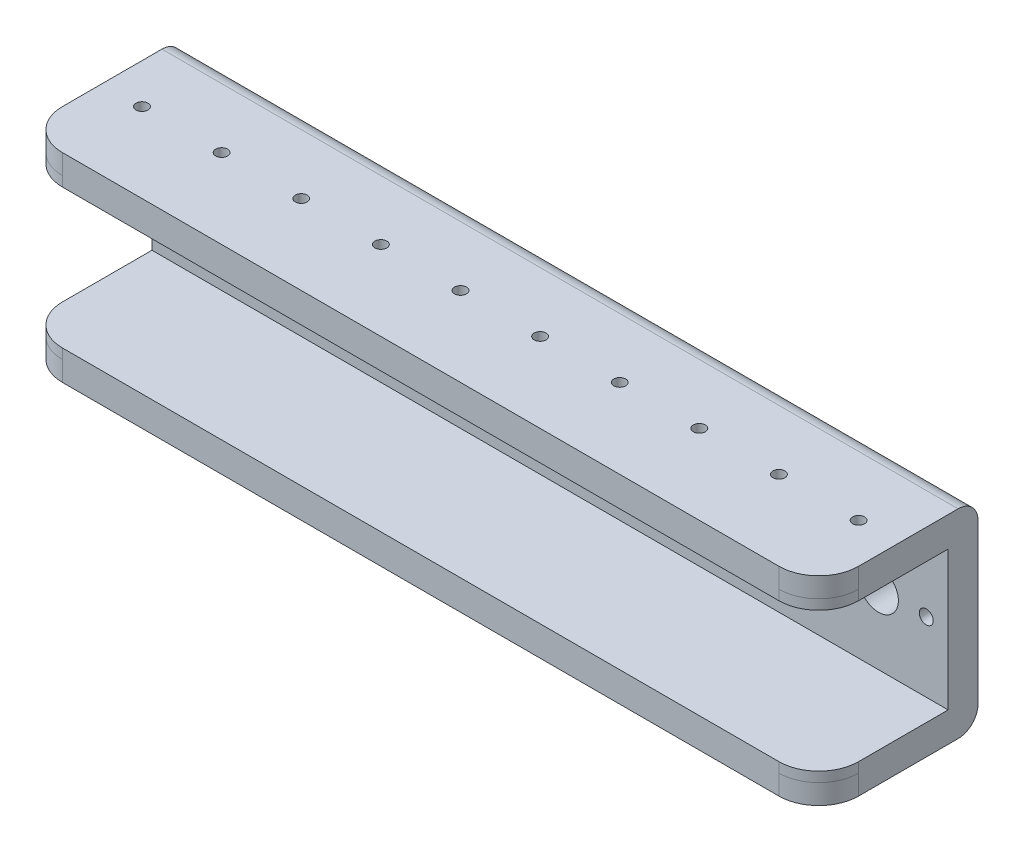
from build123d import *

# Parameters (mm, degrees)
SKETCH1_W           = 400
SKETCH1_H           = 80
BOSS_EXTRUDE1_DEPTH = 10
SKETCH2_W           = 400
SKETCH2_H           = 10
BOSS_EXTRUDE2_DEPTH = 80
SKETCH3_W           = 400
SKETCH3_H           = 10
BOSS_EXTRUDE3_DEPTH = 10
SKETCH4_W           = 400
SKETCH4_H           = 10
BOSS_EXTRUDE4_DEPTH = 70
FILLET1_R           = 20
FILLET2_R           = 10
SKETCH7_R           = 8.5
SKETCH7_R_2         = 3.5
SKETCH7_R_3         = 10
CUT_EXTRUDE1_DEPTH  = 10
CUT_EXTRUDE2_REACH  = 358.158
SKETCH8_R           = 3
SKETCH9_W           = 400
SKETCH9_H           = 80
SKETCH9_R           = 10
SKETCH9_R_2         = 3.5
SKETCH9_R_3         = 8.5
BOSS_EXTRUDE5_DEPTH = 5
SKETCH10_W          = 400
SKETCH10_H          = 65
SKETCH10_R          = 3
BOSS_EXTRUDE6_DEPTH = 5
SKETCH11_W          = 400
SKETCH11_H          = 65
BOSS_EXTRUDE7_DEPTH = 5
FILLET3_R           = 20


with BuildPart() as part:
    # Sketch1 → Boss-Extrude1 (new body)
    with BuildSketch(Plane(origin=(0, 0, 0), x_dir=(1, 0, 0), z_dir=(0, 1, 0))):
        with Locations((135.921268108, 23.289271879)):
            Rectangle(SKETCH1_W, SKETCH1_H)
    extrude(amount=BOSS_EXTRUDE1_DEPTH)

    # Sketch2 → Boss-Extrude2 (add)
    with BuildSketch(Plane(origin=(0, 10, 0), x_dir=(1, 0, 0), z_dir=(0, 1, 0))):
        with Locations((135.921268108, 58.289271879)):
            Rectangle(SKETCH2_W, SKETCH2_H)
    extrude(amount=BOSS_EXTRUDE2_DEPTH)

    # Sketch3 → Boss-Extrude3 (add)
    with BuildSketch(Plane(origin=(0, 90, 0), x_dir=(1, 0, 0), z_dir=(0, 1, 0))):
        with Locations((135.921268108, 58.289271879)):
            Rectangle(SKETCH3_W, SKETCH3_H)
    extrude(amount=BOSS_EXTRUDE3_DEPTH)

    # Sketch4 → Boss-Extrude4 (add)
    with BuildSketch(Plane.XY.offset(-53.289271879)):
        with Locations((135.921268108, 95)):
            Rectangle(SKETCH4_W, SKETCH4_H)
    extrude(amount=BOSS_EXTRUDE4_DEPTH)

    # Fillet1
    fillet1_edges = [part.edges().sort_by_distance(p)[0] for p in [
        (-64.078731892, 95, 16.710728121),
        (335.921268108, 95, 16.710728121),
        (-64.078731892, 5, 16.710728121),
        (335.921268108, 5, 16.710728121),
    ]]
    fillet(fillet1_edges, radius=FILLET1_R)

    # Fillet2
    fillet2_edges = [part.edges().sort_by_distance(p)[0] for p in [
        (135.921268108, 100, -63.289271879),
        (135.921268108, 0, -63.289271879),
    ]]
    fillet(fillet2_edges, radius=FILLET2_R)

    # Sketch7 → Cut-Extrude1 (cut)
    with BuildSketch(Plane(origin=(0, 0, -63.289271879), x_dir=(-1, 0, 0), z_dir=(0, 0, -1))):
        with Locations((-135.921268108, 50)):
            Circle(SKETCH7_R)
        with Locations((-109.421268108, 50)):
            Circle(SKETCH7_R_2)
        with Locations((-162.421268108, 50)):
            Circle(SKETCH7_R_2)
        with Locations((-324.921268108, 50)):
            Circle(SKETCH7_R_2)
        with Locations((-300.921268108, 50)):
            Circle(SKETCH7_R_3)
        with Locations((-276.921268108, 50)):
            Circle(SKETCH7_R_2)
        with Locations((53.078731892, 50)):
            Circle(SKETCH7_R_2)
        with Locations((29.078731892, 50)):
            Circle(SKETCH7_R_3)
        with Locations((5.078731892, 50)):
            Circle(SKETCH7_R_2)
    extrude(amount=-CUT_EXTRUDE1_DEPTH, mode=Mode.SUBTRACT)

    # Sketch8 → Cut-Extrude2 (cut, up to next)
    with BuildSketch(Plane(origin=(0, 100, 0), x_dir=(1, 0, 0), z_dir=(0, 1, 0)), mode=Mode.PRIVATE) as cut_extrude2_sk1:
        with Locations(Location((-44.078731892, 23.289271879, 0), (0, 0, 270))):
            Circle(SKETCH8_R)
    cut_extrude2_tool1 = extrude(cut_extrude2_sk1.sketch, amount=-CUT_EXTRUDE2_REACH, mode=Mode.PRIVATE) & part.part
    # Sketch8 → Cut-Extrude2 (cut, up to next)
    with BuildSketch(Plane(origin=(0, 100, 0), x_dir=(1, 0, 0), z_dir=(0, 1, 0)), mode=Mode.PRIVATE) as cut_extrude2_sk2:
        with Locations(Location((-4.078731892, 23.289271879, 0), (0, 0, 270))):
            Circle(SKETCH8_R)
    cut_extrude2_tool2 = extrude(cut_extrude2_sk2.sketch, amount=-CUT_EXTRUDE2_REACH, mode=Mode.PRIVATE) & part.part
    # Sketch8 → Cut-Extrude2 (cut, up to next)
    with BuildSketch(Plane(origin=(0, 100, 0), x_dir=(1, 0, 0), z_dir=(0, 1, 0)), mode=Mode.PRIVATE) as cut_extrude2_sk3:
        with Locations(Location((35.921268108, 23.289271879, 0), (0, 0, 270))):
            Circle(SKETCH8_R)
    cut_extrude2_tool3 = extrude(cut_extrude2_sk3.sketch, amount=-CUT_EXTRUDE2_REACH, mode=Mode.PRIVATE) & part.part
    # Sketch8 → Cut-Extrude2 (cut, up to next)
    with BuildSketch(Plane(origin=(0, 100, 0), x_dir=(1, 0, 0), z_dir=(0, 1, 0)), mode=Mode.PRIVATE) as cut_extrude2_sk4:
        with Locations(Location((75.921268108, 23.289271879, 0), (0, 0, 270))):
            Circle(SKETCH8_R)
    cut_extrude2_tool4 = extrude(cut_extrude2_sk4.sketch, amount=-CUT_EXTRUDE2_REACH, mode=Mode.PRIVATE) & part.part
    # Sketch8 → Cut-Extrude2 (cut, up to next)
    with BuildSketch(Plane(origin=(0, 100, 0), x_dir=(1, 0, 0), z_dir=(0, 1, 0)), mode=Mode.PRIVATE) as cut_extrude2_sk5:
        with Locations(Location((115.921268108, 23.289271879, 0), (0, 0, 270))):
            Circle(SKETCH8_R)
    cut_extrude2_tool5 = extrude(cut_extrude2_sk5.sketch, amount=-CUT_EXTRUDE2_REACH, mode=Mode.PRIVATE) & part.part
    # Sketch8 → Cut-Extrude2 (cut, up to next)
    with BuildSketch(Plane(origin=(0, 100, 0), x_dir=(1, 0, 0), z_dir=(0, 1, 0)), mode=Mode.PRIVATE) as cut_extrude2_sk6:
        with Locations(Location((155.921268108, 23.289271879, 0), (0, 0, 270))):
            Circle(SKETCH8_R)
    cut_extrude2_tool6 = extrude(cut_extrude2_sk6.sketch, amount=-CUT_EXTRUDE2_REACH, mode=Mode.PRIVATE) & part.part
    # Sketch8 → Cut-Extrude2 (cut, up to next)
    with BuildSketch(Plane(origin=(0, 100, 0), x_dir=(1, 0, 0), z_dir=(0, 1, 0)), mode=Mode.PRIVATE) as cut_extrude2_sk7:
        with Locations(Location((195.921268108, 23.289271879, 0), (0, 0, 270))):
            Circle(SKETCH8_R)
    cut_extrude2_tool7 = extrude(cut_extrude2_sk7.sketch, amount=-CUT_EXTRUDE2_REACH, mode=Mode.PRIVATE) & part.part
    # Sketch8 → Cut-Extrude2 (cut, up to next)
    with BuildSketch(Plane(origin=(0, 100, 0), x_dir=(1, 0, 0), z_dir=(0, 1, 0)), mode=Mode.PRIVATE) as cut_extrude2_sk8:
        with Locations(Location((235.921268108, 23.289271879, 0), (0, 0, 270))):
            Circle(SKETCH8_R)
    cut_extrude2_tool8 = extrude(cut_extrude2_sk8.sketch, amount=-CUT_EXTRUDE2_REACH, mode=Mode.PRIVATE) & part.part
    # Sketch8 → Cut-Extrude2 (cut, up to next)
    with BuildSketch(Plane(origin=(0, 100, 0), x_dir=(1, 0, 0), z_dir=(0, 1, 0)), mode=Mode.PRIVATE) as cut_extrude2_sk9:
        with Locations(Location((275.921268108, 23.289271879, 0), (0, 0, 270))):
            Circle(SKETCH8_R)
    cut_extrude2_tool9 = extrude(cut_extrude2_sk9.sketch, amount=-CUT_EXTRUDE2_REACH, mode=Mode.PRIVATE) & part.part
    # Sketch8 → Cut-Extrude2 (cut, up to next)
    with BuildSketch(Plane(origin=(0, 100, 0), x_dir=(1, 0, 0), z_dir=(0, 1, 0)), mode=Mode.PRIVATE) as cut_extrude2_sk10:
        with Locations(Location((315.921268108, 23.289271879, 0), (0, 0, 270))):
            Circle(SKETCH8_R)
    cut_extrude2_tool10 = extrude(cut_extrude2_sk10.sketch, amount=-CUT_EXTRUDE2_REACH, mode=Mode.PRIVATE) & part.part
    add(cut_extrude2_tool1.solids().sort_by_distance((-44.078732, 100, -23.289272))[0], mode=Mode.SUBTRACT)
    add(cut_extrude2_tool2.solids().sort_by_distance((-4.078732, 100, -23.289272))[0], mode=Mode.SUBTRACT)
    add(cut_extrude2_tool3.solids().sort_by_distance((35.921268, 100, -23.289272))[0], mode=Mode.SUBTRACT)
    add(cut_extrude2_tool4.solids().sort_by_distance((75.921268, 100, -23.289272))[0], mode=Mode.SUBTRACT)
    add(cut_extrude2_tool5.solids().sort_by_distance((115.921268, 100, -23.289272))[0], mode=Mode.SUBTRACT)
    add(cut_extrude2_tool6.solids().sort_by_distance((155.921268, 100, -23.289272))[0], mode=Mode.SUBTRACT)
    add(cut_extrude2_tool7.solids().sort_by_distance((195.921268, 100, -23.289272))[0], mode=Mode.SUBTRACT)
    add(cut_extrude2_tool8.solids().sort_by_distance((235.921268, 100, -23.289272))[0], mode=Mode.SUBTRACT)
    add(cut_extrude2_tool9.solids().sort_by_distance((275.921268, 100, -23.289272))[0], mode=Mode.SUBTRACT)
    add(cut_extrude2_tool10.solids().sort_by_distance((315.921268, 100, -23.289272))[0], mode=Mode.SUBTRACT)

    # Sketch9 → Boss-Extrude5 (add)
    with BuildSketch(Plane.XY.offset(-53.289271879)):
        with Locations((135.921268108, 50)):
            Rectangle(SKETCH9_W, SKETCH9_H)
        with Locations(Location((-29.078731892, 50, 0), (0, 0, 180))):
            Circle(SKETCH9_R, mode=Mode.SUBTRACT)
        with Locations(Location((-5.078731892, 50, 0), (0, 0, 180))):
            Circle(SKETCH9_R_2, mode=Mode.SUBTRACT)
        with Locations(Location((-53.078731892, 50, 0), (0, 0, 180))):
            Circle(SKETCH9_R_2, mode=Mode.SUBTRACT)
        with Locations(Location((135.921268108, 50, 0), (0, 0, 180))):
            Circle(SKETCH9_R_3, mode=Mode.SUBTRACT)
        with Locations(Location((109.421268108, 50, 0), (0, 0, 180))):
            Circle(SKETCH9_R_2, mode=Mode.SUBTRACT)
        with Locations(Location((162.421268108, 50, 0), (0, 0, 180))):
            Circle(SKETCH9_R_2, mode=Mode.SUBTRACT)
        with Locations(Location((300.921268108, 50, 0), (0, 0, 180))):
            Circle(SKETCH9_R, mode=Mode.SUBTRACT)
        with Locations(Location((324.921268108, 50, 0), (0, 0, 180))):
            Circle(SKETCH9_R_2, mode=Mode.SUBTRACT)
        with Locations(Location((276.921268108, 50, 0), (0, 0, 180))):
            Circle(SKETCH9_R_2, mode=Mode.SUBTRACT)
    extrude(amount=BOSS_EXTRUDE5_DEPTH)

    # Sketch10 → Boss-Extrude6 (add)
    with BuildSketch(Plane.XZ.offset(-90)):
        with Locations((135.921268108, -15.789271879)):
            Rectangle(SKETCH10_W, SKETCH10_H)
        with Locations(Location((-44.078731892, -23.289271879, 0), (0, 0, 90))):
            Circle(SKETCH10_R, mode=Mode.SUBTRACT)
        with Locations(Location((-4.078731892, -23.289271879, 0), (0, 0, 90))):
            Circle(SKETCH10_R, mode=Mode.SUBTRACT)
        with Locations(Location((35.921268108, -23.289271879, 0), (0, 0, 90))):
            Circle(SKETCH10_R, mode=Mode.SUBTRACT)
        with Locations(Location((75.921268108, -23.289271879, 0), (0, 0, 90))):
            Circle(SKETCH10_R, mode=Mode.SUBTRACT)
        with Locations(Location((115.921268108, -23.289271879, 0), (0, 0, 90))):
            Circle(SKETCH10_R, mode=Mode.SUBTRACT)
        with Locations(Location((155.921268108, -23.289271879, 0), (0, 0, 90))):
            Circle(SKETCH10_R, mode=Mode.SUBTRACT)
        with Locations(Location((195.921268108, -23.289271879, 0), (0, 0, 90))):
            Circle(SKETCH10_R, mode=Mode.SUBTRACT)
        with Locations(Location((235.921268108, -23.289271879, 0), (0, 0, 90))):
            Circle(SKETCH10_R, mode=Mode.SUBTRACT)
        with Locations(Location((275.921268108, -23.289271879, 0), (0, 0, 90))):
            Circle(SKETCH10_R, mode=Mode.SUBTRACT)
        with Locations(Location((315.921268108, -23.289271879, 0), (0, 0, 90))):
            Circle(SKETCH10_R, mode=Mode.SUBTRACT)
    extrude(amount=BOSS_EXTRUDE6_DEPTH)

    # Sketch11 → Boss-Extrude7 (add)
    with BuildSketch(Plane(origin=(0, 10, 0), x_dir=(1, 0, 0), z_dir=(0, 1, 0))):
        with Locations((135.921268108, 15.789271879)):
            Rectangle(SKETCH11_W, SKETCH11_H)
    extrude(amount=BOSS_EXTRUDE7_DEPTH)

    # Fillet3
    fillet3_edges = [part.edges().sort_by_distance(p)[0] for p in [
        (335.921268108, 12.5, 16.710728121),
        (335.921268108, 87.5, 16.710728121),
        (-64.078731892, 12.5, 16.710728121),
        (-64.078731892, 87.5, 16.710728121),
    ]]
    fillet(fillet3_edges, radius=FILLET3_R)


solid = part.part
